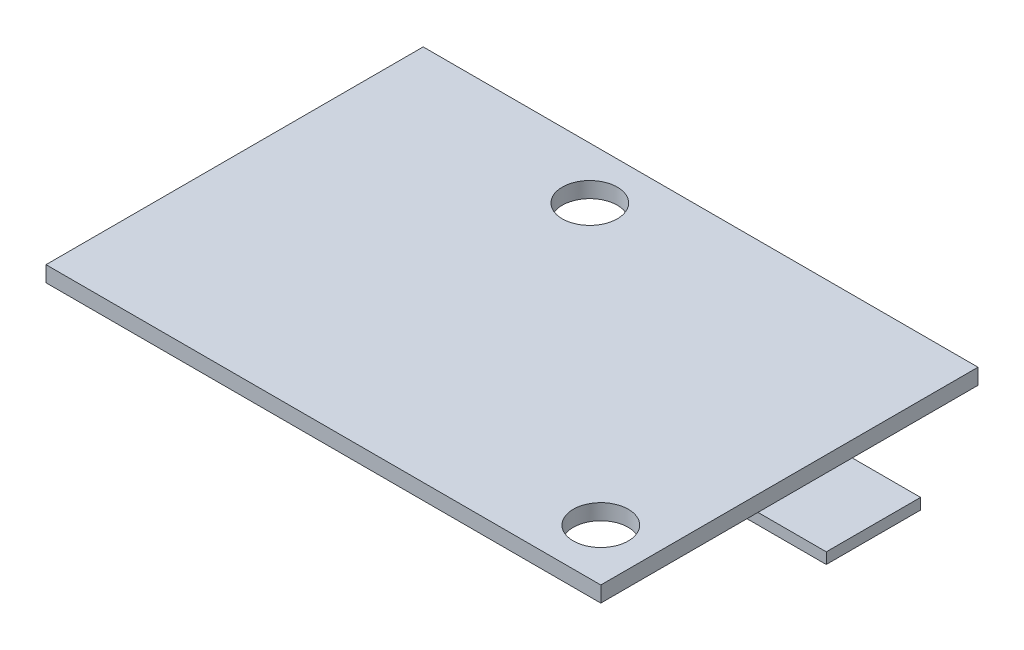
from build123d import *

# Parameters (mm, degrees)
SKETCH1_W                  = 35.3
SKETCH1_H                  = 24
BOSS_EXTRUDE1_DEPTH        = 1
F_3_5_3_5_DIAMETER_HOLE1_D = 3.5
SKETCH5_W                  = 7.129651431
SKETCH5_H                  = 6
BOSS_EXTRUDE2_DEPTH        = 0.7


with BuildPart() as part:
    # Sketch1 → Boss-Extrude1 (new body)
    with BuildSketch(Plane(origin=(0, 0, 0), x_dir=(1, 0, 0), z_dir=(0, 1, 0))):
        Rectangle(SKETCH1_W, SKETCH1_H)
    extrude(amount=BOSS_EXTRUDE1_DEPTH)

    # Ø3.5 (3.5) Diameter Hole1 (through all)
    with Locations(Plane(origin=(0, 1, 0), x_dir=(1, 0, 0), z_dir=(0, 1, 0))):
        with Locations((-3.75, 8.7), (14.35, -8.7)):
            Hole(F_3_5_3_5_DIAMETER_HOLE1_D / 2)

    # Sketch5 → Boss-Extrude2 (add)
    with BuildSketch(Plane.XZ):
        with Locations((18.431222248, -1)):
            Rectangle(SKETCH5_W, SKETCH5_H)
    extrude(amount=BOSS_EXTRUDE2_DEPTH)


solid = part.part
